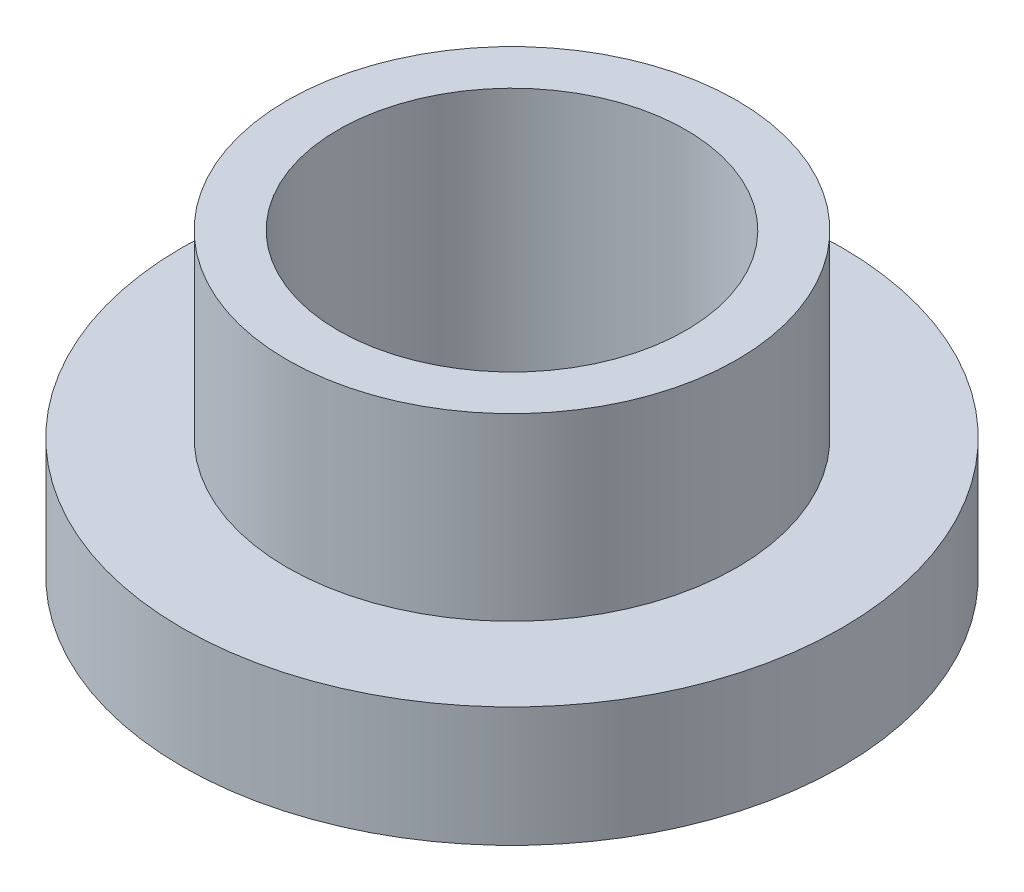
from build123d import *

# Parameters (mm, degrees)
ESQUISSE1_R        = 5.5
ESQUISSE1_R_2      = 2.9
BOSS_EXTRU_1_DEPTH = 2
ESQUISSE2_R        = 3.75
ESQUISSE2_R_2      = 2.9
BOSS_EXTRU_2_DEPTH = 3


with BuildPart() as part:
    # Esquisse1 → Boss.-Extru.1 (new body)
    with BuildSketch(Plane(origin=(0, 0, 0), x_dir=(1, 0, 0), z_dir=(0, 1, 0))):
        with Locations(Location((0, 0, 0), (0, 0, 270))):
            Circle(ESQUISSE1_R)
        with Locations(Location((0, 0, 0), (0, 0, 270))):
            Circle(ESQUISSE1_R_2, mode=Mode.SUBTRACT)
    extrude(amount=BOSS_EXTRU_1_DEPTH)

    # Esquisse2 → Boss.-Extru.2 (add)
    with BuildSketch(Plane(origin=(0, 2, 0), x_dir=(1, 0, 0), z_dir=(0, 1, 0))):
        with Locations(Location((0, 0, 0), (0, 0, 270))):
            Circle(ESQUISSE2_R)
        with Locations(Location((0, 0, 0), (0, 0, 270))):
            Circle(ESQUISSE2_R_2, mode=Mode.SUBTRACT)
    extrude(amount=BOSS_EXTRU_2_DEPTH)


solid = part.part
